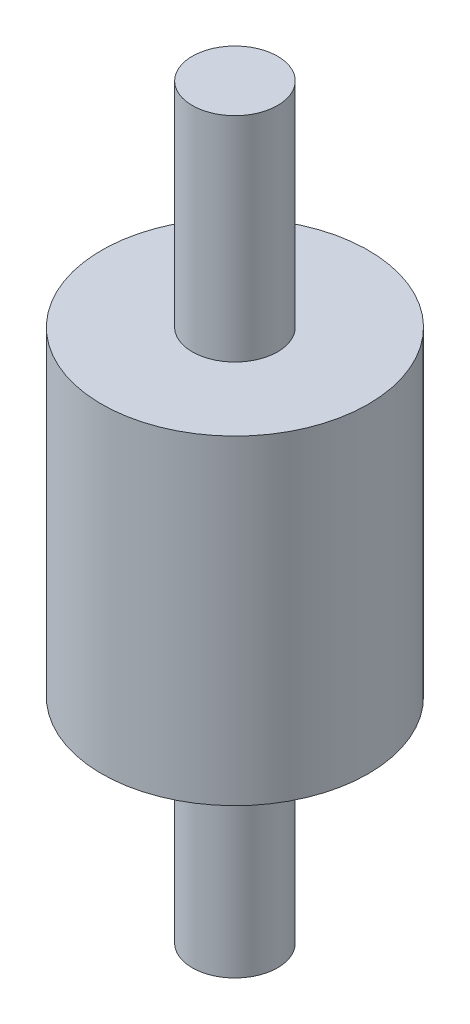
from build123d import *


with BuildPart() as part:
    # Sketch1 → Revolve1 (revolve)
    with BuildSketch(Plane.XY, mode=Mode.PRIVATE) as revolve1_sk:
        Polygon((0, 70), (-4, 70), (-4, 50), (-12.5, 50), (-12.5, 20), (-4, 20), (-4, 0), (0, 0), align=None)
    revolve(revolve1_sk.sketch.rotate(Axis((0, 0, 0), (0, 1, 0)), 180), axis=Axis((0, 0, 0), (0, 1, 0)))


solid = part.part
